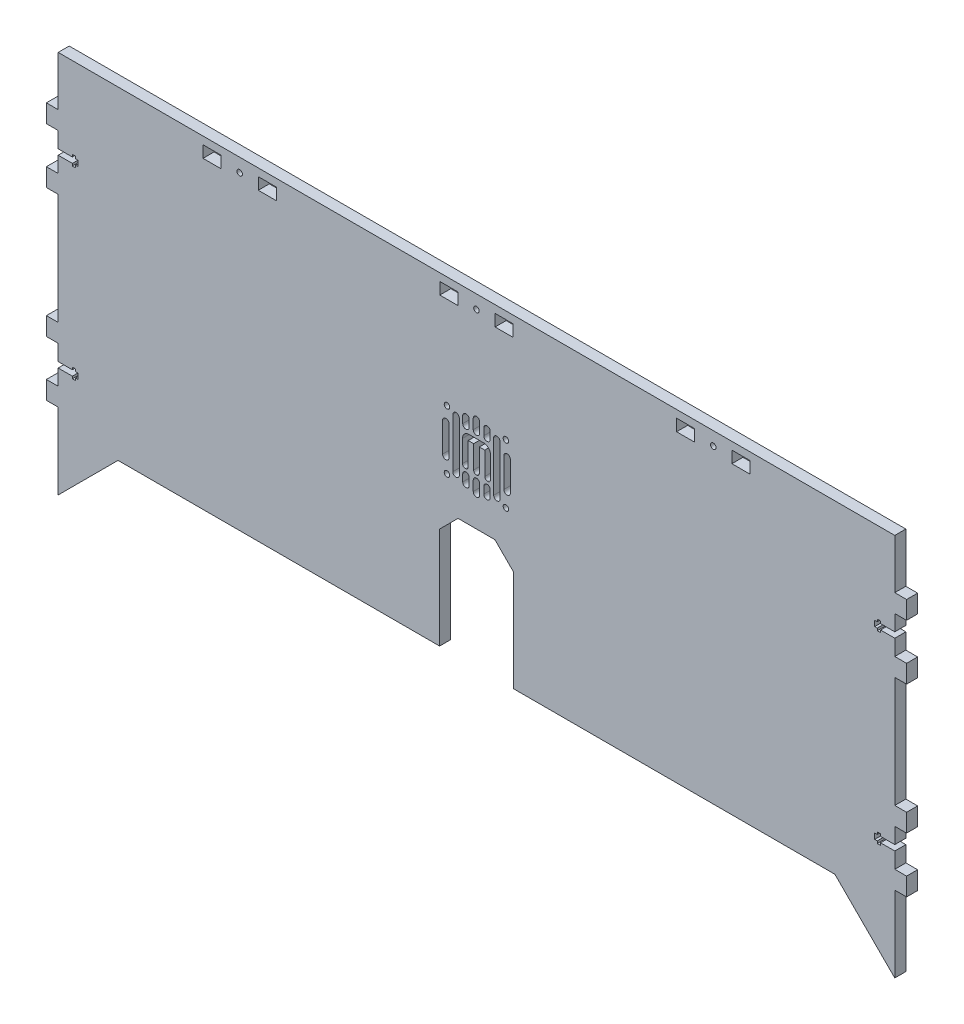
from build123d import *

# Parameters (mm, degrees)
SKETCH1_R           = 1.5
SKETCH1_W           = 9.8
SKETCH1_H           = 6.4
BOSS_EXTRUDE1_DEPTH = 6


with BuildPart() as part:
    # Sketch1 → Boss-Extrude1 (new body)
    with BuildSketch(Plane.XY):
        Polygon((-200.414586188, -68.905981805), (-25.909747478, -68.905981805), (-25.909747478, -13.905981805), (-15.909747478, -3.905981805), (4.090252522, -3.905981805), (14.090252522, -13.905981805), (14.090252522, -68.905981805), (188.595091232, -68.905981805), (221.090252522, -101.401143096), (221.090252522, -60.111143096), (227.490252522, -60.111143096), (227.490252522, -50.311143096), (221.090252522, -50.311143096), (221.090252522, -41.711822683), (213.390252522, -41.711822683), (213.390252522, -42.960463509), (211.590252522, -42.960463509), (211.590252522, -41.711822683), (210.190252522, -41.711822683), (210.190252522, -38.710463509), (211.590252522, -38.710463509), (211.590252522, -37.460463509), (213.390252522, -37.460463509), (213.390252522, -38.710463509), (221.090252522, -38.710463509), (221.090252522, -30.111143096), (227.490252522, -30.111143096), (227.490252522, -20.311143096), (221.090252522, -20.311143096), (221.090252522, 39.888856904), (227.490252522, 39.888856904), (227.490252522, 49.688856904), (221.090252522, 49.688856904), (221.090252522, 58.288177317), (213.390252522, 58.288177317), (213.390252522, 57.039536491), (211.590252522, 57.039536491), (211.590252522, 58.288177317), (210.190252522, 58.288177317), (210.190252522, 61.289536491), (211.590252522, 61.289536491), (211.590252522, 62.539536491), (213.390252522, 62.539536491), (213.390252522, 61.289536491), (221.090252522, 61.289536491), (221.090252522, 69.888856904), (227.490252522, 69.888856904), (227.490252522, 79.688856904), (221.090252522, 79.688856904), (221.090252522, 106.598856904), (106.090252522, 106.598856904), (91.090252522, 106.598856904), (-102.909747478, 106.598856904), (-117.909747478, 106.598856904), (-232.909747478, 106.598856904), (-232.909747478, 79.688856904), (-239.309747478, 79.688856904), (-239.309747478, 69.888856904), (-232.909747478, 69.888856904), (-232.909747478, 61.289536491), (-225.209747478, 61.289536491), (-225.209747478, 62.539536491), (-223.409747478, 62.539536491), (-223.409747478, 61.289536491), (-222.009747478, 61.289536491), (-222.009747478, 58.288177317), (-223.409747478, 58.288177317), (-223.409747478, 57.039536491), (-225.209747478, 57.039536491), (-225.209747478, 58.288177317), (-232.909747478, 58.288177317), (-232.909747478, 49.688856904), (-239.309747478, 49.688856904), (-239.309747478, 39.888856904), (-232.909747478, 39.888856904), (-232.909747478, -20.311143096), (-239.309747478, -20.311143096), (-239.309747478, -30.111143096), (-232.909747478, -30.111143096), (-232.909747478, -38.710463509), (-225.209747478, -38.710463509), (-225.209747478, -37.460463509), (-223.409747478, -37.460463509), (-223.409747478, -38.710463509), (-222.009747478, -38.710463509), (-222.009747478, -41.711822683), (-223.409747478, -41.711822683), (-223.409747478, -42.960463509), (-225.209747478, -42.960463509), (-225.209747478, -41.711822683), (-232.909747478, -41.711822683), (-232.909747478, -50.311143096), (-239.309747478, -50.311143096), (-239.309747478, -60.111143096), (-232.909747478, -60.111143096), (-232.909747478, -101.401143096), align=None)
        with Locations(Location((-134.409747478, 99.298856904, 0), (0, 0, 180))):
            Circle(SKETCH1_R, mode=Mode.SUBTRACT)
        with Locations(Location((122.590252522, 99.298856904, 0), (0, 0, 180))):
            Circle(SKETCH1_R, mode=Mode.SUBTRACT)
        with Locations((-21.909747478, 46.033182278)):
            Circle(SKETCH1_R, mode=Mode.SUBTRACT)
        with Locations(Location((-5.909747478, 99.298856904, 0), (0, 0, 180))):
            Circle(SKETCH1_R, mode=Mode.SUBTRACT)
        with Locations(Location((10.090252522, 46.033182278, 0), (0, 0, 180))):
            Circle(SKETCH1_R, mode=Mode.SUBTRACT)
        with Locations((10.090252522, 14.033182278)):
            Circle(SKETCH1_R, mode=Mode.SUBTRACT)
        with Locations(Location((-21.909747478, 14.033182278, 0), (0, 0, 180))):
            Circle(SKETCH1_R, mode=Mode.SUBTRACT)
        with Locations((-119.409067891, 99.298856904)):
            Rectangle(SKETCH1_W, SKETCH1_H, mode=Mode.SUBTRACT)
        with Locations((-149.410427065, 99.298856904)):
            Rectangle(SKETCH1_W, SKETCH1_H, mode=Mode.SUBTRACT)
        with Locations((-20.910427065, 99.298856904)):
            Rectangle(SKETCH1_W, SKETCH1_H, mode=Mode.SUBTRACT)
        with Locations((9.090932109, 99.298856904)):
            Rectangle(SKETCH1_W, SKETCH1_H, mode=Mode.SUBTRACT)
        with BuildLine():
            Line((0.095706293, 21.520572632), (0.180650719, 21.520675257))
            add(Edge.make_bspline(
                [(0.180650719, 21.520675257), (1.69312554, 21.52093079), (1.692920393, 23.033405681)],
                knots=[5.498023912, 5.498023912, 5.498023912, 7.068651289, 7.068651289, 7.068651289], degree=2, weights=[1, 0.707166512, 1]))
            Line((1.692920393, 23.033405681), (1.692920393, 34.872945339))
            ThreePointArc((1.692920393, 34.872945339), (0.617345831, 37.469612035), (-1.979320864, 38.545186596))
            Line((-1.979320864, 38.545186596), (-9.844320864, 38.545186596))
            ThreePointArc((-9.844320864, 38.545186596), (-12.440987558, 37.469612034), (-13.516562118, 34.872945339))
            Line((-13.516562118, 34.872945339), (-13.516562118, 23.033405681))
            add(Edge.make_bspline(
                [(-13.516562118, 23.033405681), (-13.516767264, 21.520930794), (-12.004292448, 21.520675261)],
                knots=[5.497719326, 5.497719326, 5.497719326, 7.068346702, 7.068346702, 7.068346702], degree=2, weights=[1, 0.707166512, 1]))
            Line((-12.004292448, 21.520675261), (-11.919349264, 21.520905605))
            add(Edge.make_bspline(
                [(-11.919349264, 21.520905605), (-10.406874448, 21.521161138), (-10.407079594, 23.033636025)],
                knots=[5.498023912, 5.498023912, 5.498023912, 7.068651289, 7.068651289, 7.068651289], degree=2, weights=[1, 0.707166512, 1]))
            Line((-10.407079594, 23.033636025), (-10.407079594, 35.435934426))
            Line((-10.407079594, 35.435934426), (-7.466562121, 35.435934426))
            Line((-7.466562121, 35.435934426), (-7.466562121, 23.03320403))
            add(Edge.make_bspline(
                [(-7.466562121, 23.03320403), (-7.466562121, 21.520934285), (-5.954292447, 21.520473669)],
                knots=[5.497787144, 5.497787144, 5.497787144, 7.068278884, 7.068278884, 7.068278884], degree=2, weights=[1, 0.707214461, 1]))
            Line((-5.954292447, 21.520473669), (-5.869349265, 21.520704012))
            add(Edge.make_bspline(
                [(-5.869349265, 21.520704012), (-4.35679165, 21.520877089), (-4.357079903, 23.033434774)],
                knots=[5.497996547, 5.497996547, 5.497996547, 7.068678654, 7.068678654, 7.068678654], degree=2, weights=[1, 0.707147163, 1]))
            Line((-4.357079903, 23.033434774), (-4.357079903, 35.435934756))
            Line((-4.357079903, 35.435934756), (-1.416563394, 35.435934756))
            Line((-1.416563394, 35.435934756), (-1.416563394, 23.033200469))
            add(Edge.make_bspline(
                [(-1.416563394, 23.033200469), (-1.41666596, 21.520828148), (0.095706293, 21.520572632)],
                knots=[5.497787144, 5.497787144, 5.497787144, 7.068346702, 7.068346702, 7.068346702], degree=2, weights=[1, 0.707190487, 1]))
        make_face(mode=Mode.SUBTRACT)
        with Locations((137.590932109, 99.298856904)):
            Rectangle(SKETCH1_W, SKETCH1_H, mode=Mode.SUBTRACT)
        with Locations((107.589572935, 99.298856904)):
            Rectangle(SKETCH1_W, SKETCH1_H, mode=Mode.SUBTRACT)
        with BuildLine():
            Line((-9.874684918, 18.268879993), (-9.874684918, 14.468912424))
            ThreePointArc((-9.874684918, 14.468912424), (-11.624684918, 12.718912424), (-13.374684918, 14.468912424))
            Line((-13.374684918, 14.468912424), (-13.374684918, 18.268879993))
            ThreePointArc((-13.374684918, 18.268879993), (-11.624684918, 20.018879993), (-9.874684918, 18.268879993))
        make_face(mode=Mode.SUBTRACT)
        with BuildLine():
            Line((1.555189962, 14.468912424), (1.555189962, 18.268879993))
            ThreePointArc((1.555189962, 18.268879993), (-0.194810038, 20.018879993), (-1.944810038, 18.268879993))
            Line((-1.944810038, 18.268879993), (-1.944810038, 14.468912424))
            ThreePointArc((-1.944810038, 14.468912424), (-0.194810038, 12.718912424), (1.555189962, 14.468912424))
        make_face(mode=Mode.SUBTRACT)
        with BuildLine():
            Line((-7.659747478, 18.268879993), (-7.659747478, 12.844018195))
            ThreePointArc((-7.659747478, 12.844018195), (-5.909747478, 11.094018195), (-4.159747478, 12.844018195))
            Line((-4.159747478, 12.844018195), (-4.159747478, 18.268879993))
            ThreePointArc((-4.159747478, 18.268879993), (-5.909747478, 20.018879993), (-7.659747478, 18.268879993))
        make_face(mode=Mode.SUBTRACT)
        with BuildLine():
            Line((12.468189962, 38.047549426), (12.468189962, 22.118879993))
            ThreePointArc((12.468189962, 22.118879993), (10.718189962, 20.368879993), (8.968189962, 22.118879993))
            Line((8.968189962, 22.118879993), (8.968189962, 38.047549426))
            ThreePointArc((8.968189962, 38.047549426), (10.718189962, 39.797549426), (12.468189962, 38.047549426))
        make_face(mode=Mode.SUBTRACT)
        with BuildLine():
            Line((3.424189962, 16.618879993), (3.424189962, 43.547549426))
            ThreePointArc((3.424189962, 43.547549426), (5.174189962, 45.297549426), (6.924189962, 43.547549426))
            Line((6.924189962, 43.547549426), (6.924189962, 16.618879993))
            ThreePointArc((6.924189962, 16.618879993), (5.174189962, 14.868879993), (3.424189962, 16.618879993))
        make_face(mode=Mode.SUBTRACT)
        with BuildLine():
            Line((-24.287684918, 38.047549426), (-24.287684918, 22.118879993))
            ThreePointArc((-24.287684918, 22.118879993), (-22.537684918, 20.368879993), (-20.787684918, 22.118879993))
            Line((-20.787684918, 22.118879993), (-20.787684918, 38.047549426))
            ThreePointArc((-20.787684918, 38.047549426), (-22.537684918, 39.797549426), (-24.287684918, 38.047549426))
        make_face(mode=Mode.SUBTRACT)
        with BuildLine():
            Line((-4.159747478, 41.897549426), (-4.159747478, 47.322411224))
            ThreePointArc((-4.159747478, 47.322411224), (-5.909747478, 49.072411224), (-7.659747478, 47.322411224))
            Line((-7.659747478, 47.322411224), (-7.659747478, 41.897549426))
            ThreePointArc((-7.659747478, 41.897549426), (-5.909747478, 40.147549426), (-4.159747478, 41.897549426))
        make_face(mode=Mode.SUBTRACT)
        with BuildLine():
            Line((-1.944810038, 41.897549426), (-1.944810038, 45.697516995))
            ThreePointArc((-1.944810038, 45.697516995), (-0.194810038, 47.447516995), (1.555189962, 45.697516995))
            Line((1.555189962, 45.697516995), (1.555189962, 41.897549426))
            ThreePointArc((1.555189962, 41.897549426), (-0.194810038, 40.147549426), (-1.944810038, 41.897549426))
        make_face(mode=Mode.SUBTRACT)
        with BuildLine():
            Line((-18.743684918, 43.547549426), (-18.743684918, 16.618879993))
            ThreePointArc((-18.743684918, 16.618879993), (-16.993684918, 14.868879993), (-15.243684918, 16.618879993))
            Line((-15.243684918, 16.618879993), (-15.243684918, 43.547549426))
            ThreePointArc((-15.243684918, 43.547549426), (-16.993684918, 45.297549426), (-18.743684918, 43.547549426))
        make_face(mode=Mode.SUBTRACT)
        with BuildLine():
            Line((-13.374684918, 45.697516995), (-13.374684918, 41.897549426))
            ThreePointArc((-13.374684918, 41.897549426), (-11.624684918, 40.147549426), (-9.874684918, 41.897549426))
            Line((-9.874684918, 41.897549426), (-9.874684918, 45.697516995))
            ThreePointArc((-9.874684918, 45.697516995), (-11.624684918, 47.447516995), (-13.374684918, 45.697516995))
        make_face(mode=Mode.SUBTRACT)
    extrude(amount=BOSS_EXTRUDE1_DEPTH)


solid = part.part
